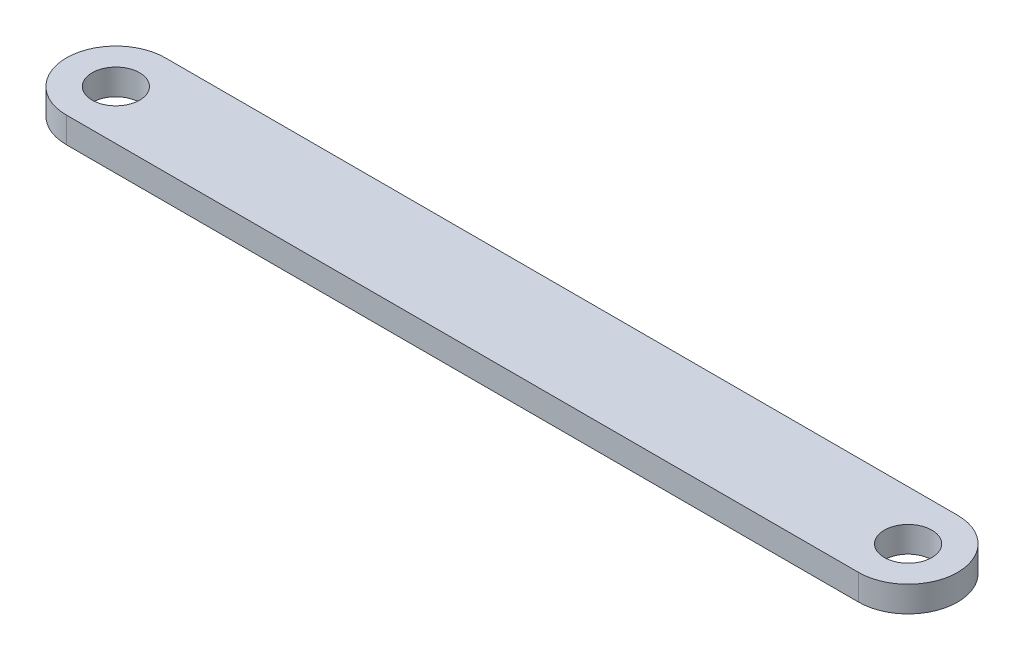
from build123d import *

# Parameters (mm, degrees)
SKETCH1_R           = 6
BOSS_EXTRUDE1_DEPTH = 6.5


with BuildPart() as part:
    # Sketch1 → Boss-Extrude1 (new body)
    with BuildSketch(Plane(origin=(0, 0, 0), x_dir=(1, 0, 0), z_dir=(0, 1, 0))):
        with BuildLine():
            Line((100, -12.5), (-100, -12.5))
            ThreePointArc((-100, -12.5), (-112.5, 0), (-100, 12.5))
            Line((-100, 12.5), (100, 12.5))
            ThreePointArc((100, 12.5), (112.5, 0), (100, -12.5))
        make_face()
        with Locations(Location((-100, 0, 0), (0, 0, 90))):
            Circle(SKETCH1_R, mode=Mode.SUBTRACT)
        with Locations(Location((100, 0, 0), (0, 0, 90))):
            Circle(SKETCH1_R, mode=Mode.SUBTRACT)
    extrude(amount=BOSS_EXTRUDE1_DEPTH)


solid = part.part
